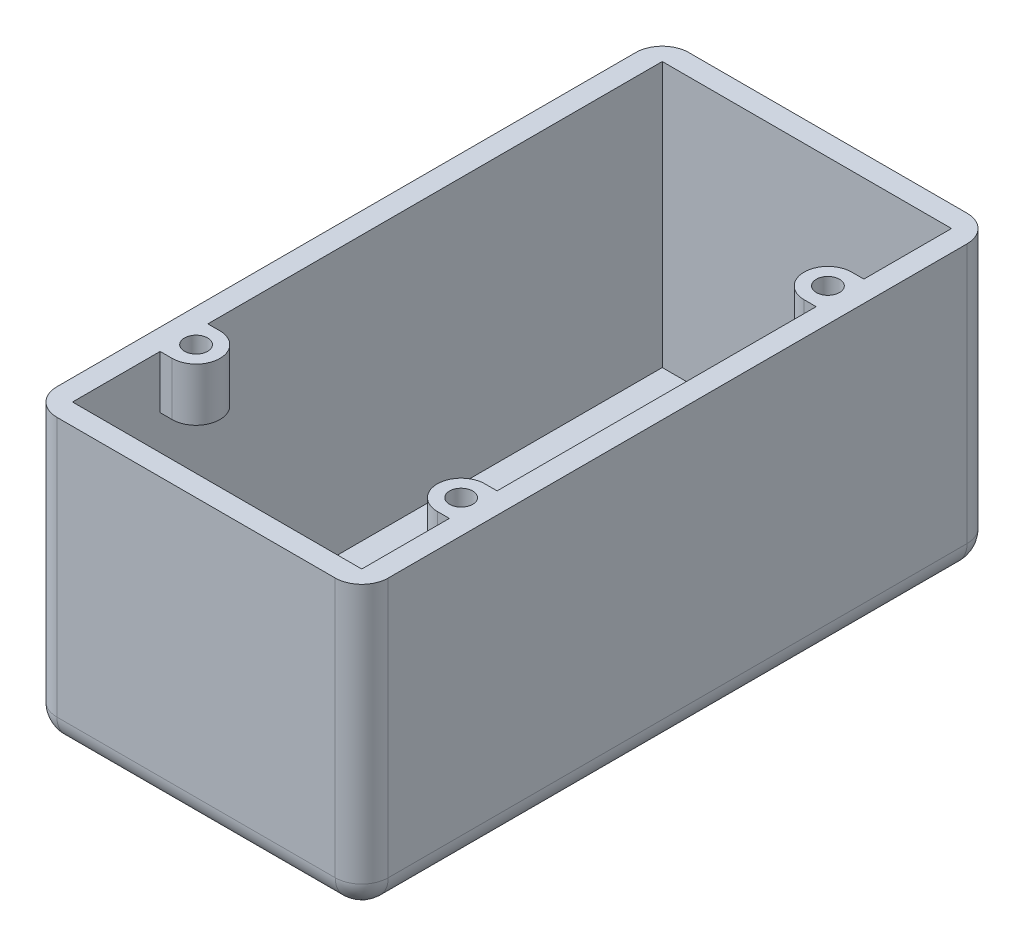
from build123d import *

# Parameters (mm, degrees)
SKETCH1_W           = 50
SKETCH1_H           = 95.35
SKETCH1_W_2         = 43.65
SKETCH1_H_2         = 89
BOSS_EXTRUDE1_DEPTH = 40
SKETCH2_W           = 50
SKETCH2_H           = 95.35
BOSS_EXTRUDE2_DEPTH = 3.175
FILLET1_R           = 4
SKETCH3_R           = 1.3
CUT_EXTRUDE1_DEPTH  = 3.175
BOSS_EXTRUDE3_DEPTH = 8
SKETCH5_R           = 1.75
CUT_EXTRUDE2_DEPTH  = 5


with BuildPart() as part:
    # Sketch1 → Boss-Extrude1 (new body)
    with BuildSketch(Plane(origin=(0, 0, 0), x_dir=(1, 0, 0), z_dir=(0, 1, 0))):
        Rectangle(SKETCH1_W, SKETCH1_H)
        Rectangle(SKETCH1_W_2, SKETCH1_H_2, mode=Mode.SUBTRACT)
    extrude(amount=BOSS_EXTRUDE1_DEPTH)

    # Sketch2 → Boss-Extrude2 (add)
    with BuildSketch(Plane.XZ):
        Rectangle(SKETCH2_W, SKETCH2_H)
    extrude(amount=BOSS_EXTRUDE2_DEPTH)

    # Fillet1
    fillet1_edges = [part.edges().sort_by_distance(p)[0] for p in [
        (25, -3.175, 0),
        (0, -3.175, 47.675),
        (-25, -3.175, 0),
        (0, -3.175, -47.675),
        (25, 18.4125, 47.675),
        (-25, 18.4125, 47.675),
        (-25, 18.4125, -47.675),
        (25, 18.4125, -47.675),
    ]]
    fillet(fillet1_edges, radius=FILLET1_R)

    # Sketch3 → Cut-Extrude1 (cut)
    with BuildSketch(Plane(origin=(0, 0, 0), x_dir=(1, 0, 0), z_dir=(0, 1, 0))):
        with Locations(Location((-15, 33.55, 0), (0, 0, 270))):
            Circle(SKETCH3_R)
        with Locations(Location((8.05, 33.55, 0), (0, 0, 270))):
            Circle(SKETCH3_R)
        with Locations(Location((8.05, -24.5, 0), (0, 0, 270))):
            Circle(SKETCH3_R)
        with Locations(Location((-15, -24.5, 0), (0, 0, 270))):
            Circle(SKETCH3_R)
    extrude(amount=-CUT_EXTRUDE1_DEPTH, mode=Mode.SUBTRACT)

    # Sketch4 → Boss-Extrude3 (add)
    with BuildSketch(Plane(origin=(0, 40, 0), x_dir=(1, 0, 0), z_dir=(0, 1, 0))):
        with BuildLine():
            Line((-20, -24.075), (-21.825, -24.075))
            Line((-21.825, -24.075), (-21.825, -31.275))
            Line((-21.825, -31.275), (-20, -31.275))
            ThreePointArc((-20, -31.275), (-16.4, -27.675), (-20, -24.075))
        make_face()
        with BuildLine():
            Line((21.825, -31.275), (20, -31.275))
            ThreePointArc((20, -31.275), (16.4, -27.675), (20, -24.075))
            Line((20, -24.075), (21.825, -24.075))
            Line((21.825, -24.075), (21.825, -31.275))
        make_face()
        with BuildLine():
            Line((20, 24.075), (21.825, 24.075))
            Line((21.825, 24.075), (21.825, 31.275))
            Line((21.825, 31.275), (20, 31.275))
            ThreePointArc((20, 31.275), (16.4, 27.675), (20, 24.075))
        make_face()
    extrude(amount=-BOSS_EXTRUDE3_DEPTH)

    # Sketch5 → Cut-Extrude2 (cut)
    with BuildSketch(Plane(origin=(0, 40, 0), x_dir=(1, 0, 0), z_dir=(0, 1, 0))):
        with Locations(Location((-20, -27.675, 0), (0, 0, 270))):
            Circle(SKETCH5_R)
        with Locations(Location((20, -27.675, 0), (0, 0, 90))):
            Circle(SKETCH5_R)
        with Locations(Location((20, 27.675, 0), (0, 0, 270))):
            Circle(SKETCH5_R)
    extrude(amount=-CUT_EXTRUDE2_DEPTH, mode=Mode.SUBTRACT)


solid = part.part
